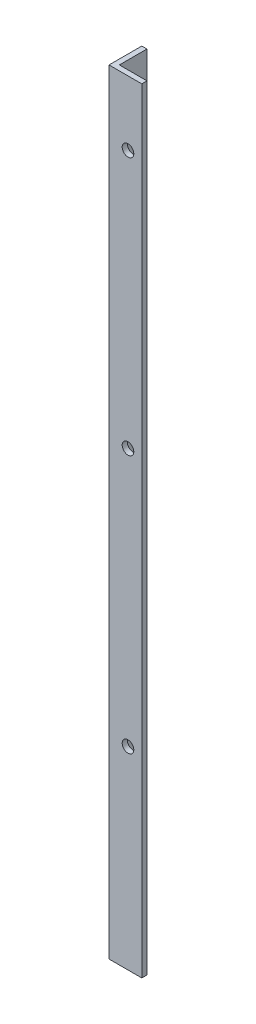
from build123d import *

# Parameters (mm, degrees)
BOSS_EXTRUDE1_DEPTH = 300
SKETCH2_R           = 2.25
CUT_EXTRUDE1_DEPTH  = 10
SKETCH3_R           = 2.25
CUT_EXTRUDE2_DEPTH  = 10
SKETCH5_R           = 2.25
CUT_EXTRUDE3_DEPTH  = 10


with BuildPart() as part:
    # Sketch1 → Boss-Extrude1 (new body)
    with BuildSketch(Plane(origin=(0, 0, 0), x_dir=(1, 0, 0), z_dir=(0, 1, 0))):
        Polygon((0, 0), (12.7, 0), (12.7, 2), (2, 2), (2, 12.7), (0, 12.7), align=None)
    extrude(amount=BOSS_EXTRUDE1_DEPTH)

    # Sketch2 → Cut-Extrude1 (cut)
    with BuildSketch(Plane(origin=(0, 0, -2), x_dir=(-1, 0, 0), z_dir=(0, 0, -1))):
        with Locations((-7.35, 275)):
            Circle(SKETCH2_R)
        with Locations((-7.35, 175)):
            Circle(SKETCH2_R)
        with Locations((-7.35, 75)):
            Circle(SKETCH2_R)
    extrude(amount=-CUT_EXTRUDE1_DEPTH, mode=Mode.SUBTRACT)

    # Sketch3 → Cut-Extrude2 (cut)
    with BuildSketch(Plane(origin=(2, 0, 0), x_dir=(0, 0, -1), z_dir=(1, 0, 0))):
        with Locations((7.35, 225)):
            Circle(SKETCH3_R)
        with Locations((7.35, 125)):
            Circle(SKETCH3_R)
        with Locations((7.35, 25)):
            Circle(SKETCH3_R)
    extrude(amount=-CUT_EXTRUDE2_DEPTH, mode=Mode.SUBTRACT)

    # Sketch5 → Cut-Extrude3 (cut)
    with BuildSketch(Plane.ZY):
        with Locations((-7.94, 253.6)):
            Circle(SKETCH5_R)
    extrude(amount=-CUT_EXTRUDE3_DEPTH, mode=Mode.SUBTRACT)


solid = part.part
